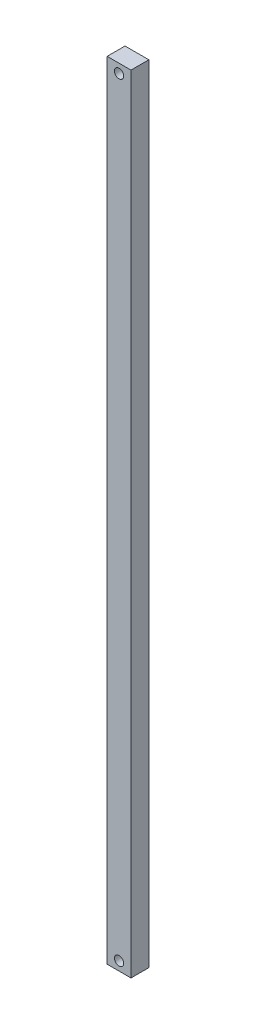
from build123d import *

# Parameters (mm, degrees)
SKETCH1_W                                      = 12.7
SKETCH1_H                                      = 9.525
BOSS_EXTRUDE1_DEPTH                            = 419.1
CBORE_FOR_8_SOCKET_HEAD_CAP_SCREW1_D           = 4.9149
CBORE_FOR_8_SOCKET_HEAD_CAP_SCREW1_CBORE_D     = 7.9375
CBORE_FOR_8_SOCKET_HEAD_CAP_SCREW1_CBORE_DEPTH = 4.1656


with BuildPart() as part:
    # Sketch1 → Boss-Extrude1 (new body)
    with BuildSketch(Plane(origin=(0, 0, 0), x_dir=(1, 0, 0), z_dir=(0, 1, 0))):
        with Locations((-0.36888069, 2.767280084)):
            Rectangle(SKETCH1_W, SKETCH1_H)
    extrude(amount=BOSS_EXTRUDE1_DEPTH)

    # CBORE for #8 Socket Head Cap Screw1 (through all)
    with Locations(Plane(origin=(0, 0, -7.529780084), x_dir=(-1, 0, 0), z_dir=(0, 0, -1))):
        with Locations((0.36888069, 414.3375), (0.36888069, 4.7625)):
            CounterBoreHole(CBORE_FOR_8_SOCKET_HEAD_CAP_SCREW1_D / 2, CBORE_FOR_8_SOCKET_HEAD_CAP_SCREW1_CBORE_D / 2, CBORE_FOR_8_SOCKET_HEAD_CAP_SCREW1_CBORE_DEPTH)


solid = part.part
